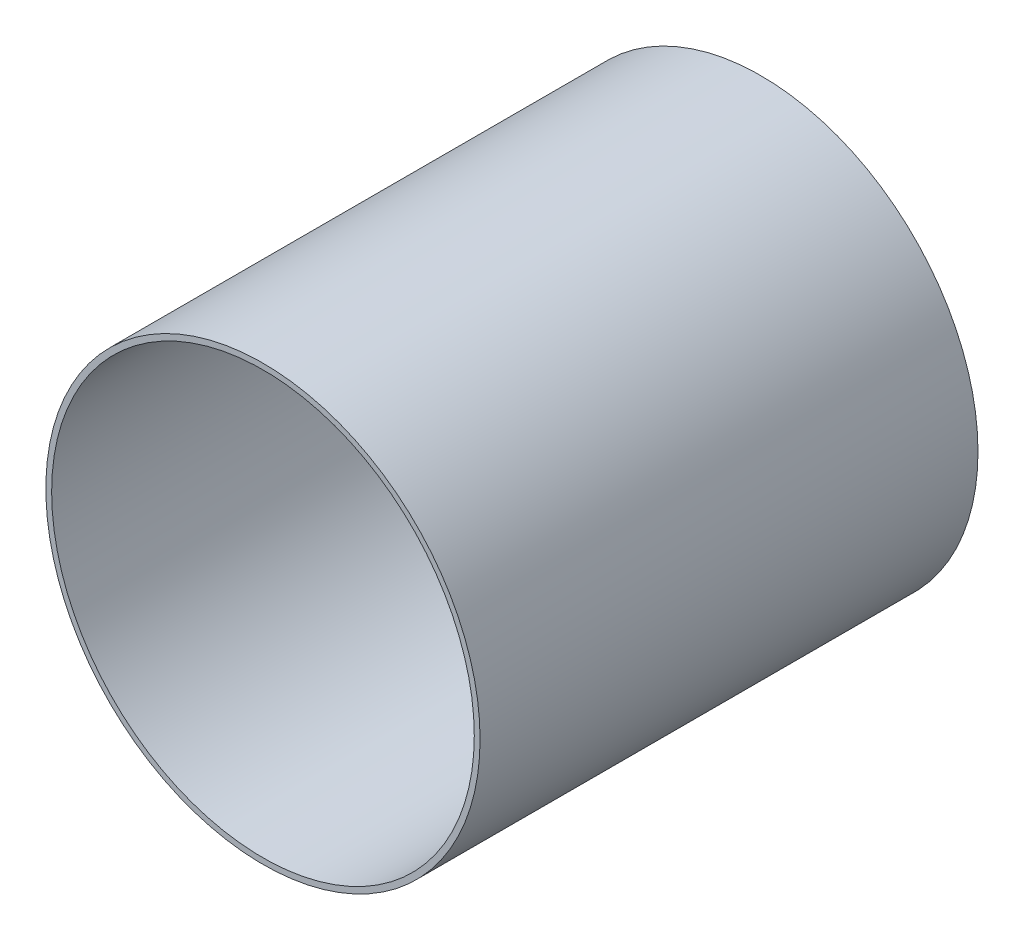
from build123d import *

# Parameters (mm, degrees)
SKETCH1_R           = 37.5
SKETCH1_R_2         = 36.5
BOSS_EXTRUDE1_DEPTH = 86


with BuildPart() as part:
    # Sketch1 → Boss-Extrude1 (new body)
    with BuildSketch(Plane.XY):
        Circle(SKETCH1_R)
        Circle(SKETCH1_R_2, mode=Mode.SUBTRACT)
    extrude(amount=BOSS_EXTRUDE1_DEPTH)


solid = part.part
